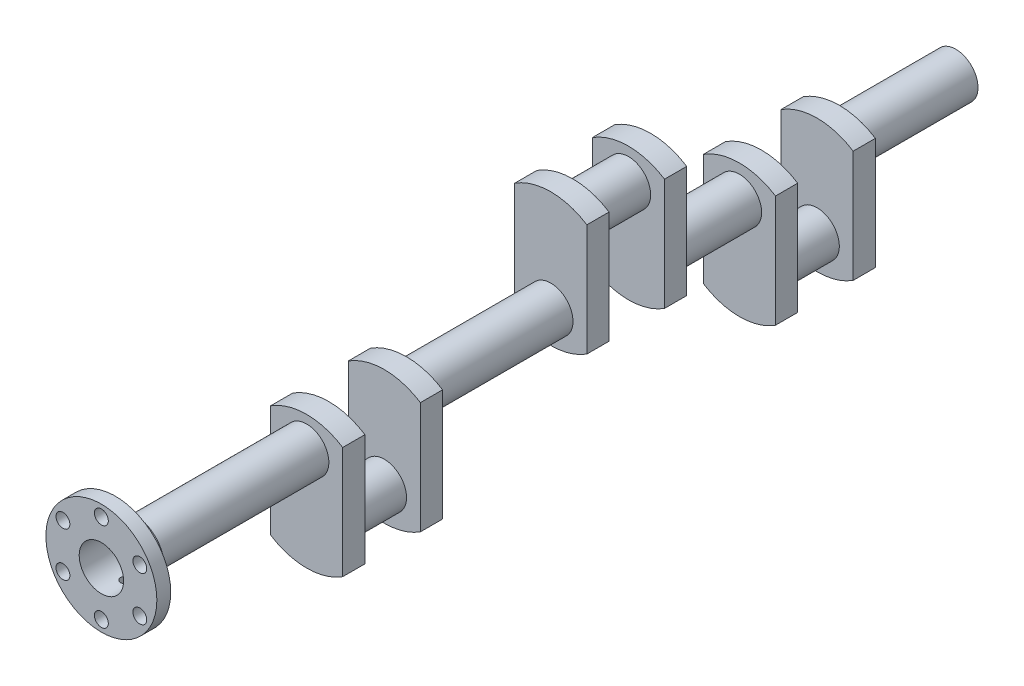
from build123d import *
from build123d.topology import SkipClean

# Parameters (mm, degrees)
SKETCH1_R            = 20
SKETCH1_R_2          = 2.5
SKETCH1_R_3          = 8
BOSS_EXTRUDE1_DEPTH  = 5
BOSS_EXTRUDE2_START  = 7
SKETCH2_R            = 10.633054962
SKETCH2_R_2          = 8
BOSS_EXTRUDE2_DEPTH  = 7
SKETCH3_R            = 8
BOSS_EXTRUDE3_DEPTH  = 62
SKETCH4_R            = 6
BOSS_EXTRUDE4_DEPTH  = 8
SKETCH5_R            = 1.5
CUT_EXTRUDE2_DEPTH   = 12.5
SKETCH6_R            = 6
BOSS_EXTRUDE6_DEPTH  = 8
SKETCH8_R            = 6
BOSS_EXTRUDE8_DEPTH  = 8
SKETCH9_R            = 8
BOSS_EXTRUDE9_DEPTH  = 20
SKETCH10_R           = 6
BOSS_EXTRUDE10_DEPTH = 8
SKETCH11_R           = 6
BOSS_EXTRUDE12_DEPTH = 8
SKETCH12_R           = 6
BOSS_EXTRUDE13_DEPTH = 8
BOSS_EXTRUDE14_START = 52
SKETCH13_R           = 8
BOSS_EXTRUDE14_DEPTH = 52
SKETCH14_R           = 6
BOSS_EXTRUDE15_DEPTH = 8
SKETCH15_R           = 6
BOSS_EXTRUDE17_DEPTH = 8
SKETCH16_R           = 6
BOSS_EXTRUDE18_DEPTH = 8
SKETCH17_R           = 8
BOSS_EXTRUDE23_DEPTH = 20
SKETCH21_R           = 6
BOSS_EXTRUDE24_DEPTH = 8
SKETCH22_R           = 6
BOSS_EXTRUDE26_DEPTH = 8
BOSS_EXTRUDE27_START = 32
SKETCH24_R           = 8
BOSS_EXTRUDE27_DEPTH = 32
SKETCH25_R           = 6
BOSS_EXTRUDE28_DEPTH = 8
SKETCH26_R           = 6
BOSS_EXTRUDE31_DEPTH = 8
SKETCH27_R           = 8
BOSS_EXTRUDE32_DEPTH = 20
SKETCH28_R           = 6
BOSS_EXTRUDE33_DEPTH = 8
SKETCH29_R           = 6
BOSS_EXTRUDE34_DEPTH = 8
BOSS_EXTRUDE35_START = 42
SKETCH30_R           = 8
BOSS_EXTRUDE35_DEPTH = 42


with BuildPart() as part:
    # Sketch1 → Boss-Extrude1 (new body)
    with BuildSketch(Plane.XY):
        Circle(SKETCH1_R)
        with Locations((0, 16)):
            Circle(SKETCH1_R_2, mode=Mode.SUBTRACT)
        with Locations((13.856406461, 8)):
            Circle(SKETCH1_R_2, mode=Mode.SUBTRACT)
        with Locations((13.856406461, -8)):
            Circle(SKETCH1_R_2, mode=Mode.SUBTRACT)
        with Locations((0, -16)):
            Circle(SKETCH1_R_2, mode=Mode.SUBTRACT)
        with Locations((-13.856406461, -8)):
            Circle(SKETCH1_R_2, mode=Mode.SUBTRACT)
        with Locations((-13.856406461, 8)):
            Circle(SKETCH1_R_2, mode=Mode.SUBTRACT)
        Circle(SKETCH1_R_3, mode=Mode.SUBTRACT)
    extrude(amount=BOSS_EXTRUDE1_DEPTH)

    # Sketch2 → Boss-Extrude2 (add)
    with SkipClean():  # the faces are left unmerged after this step: merging them gives an invalid solid
        with BuildSketch(Plane(origin=(0, 0, 0), x_dir=(-1, 0, 0), z_dir=(0, 0, -1)).offset(BOSS_EXTRUDE2_START)):
            with Locations(Location((0, 0, 0), (0, 0, 180))):
                Circle(SKETCH2_R)
            Circle(SKETCH2_R_2, mode=Mode.SUBTRACT)
        extrude(amount=-BOSS_EXTRUDE2_DEPTH)

    # Sketch5 → Cut-Extrude2 (cut, symmetric)
    with SkipClean():  # the faces are left unmerged after this step: merging them gives an invalid solid
        with BuildSketch(Plane(origin=(0, 0, 0), x_dir=(1, 0, 0), z_dir=(0, 1, 0))):
            with Locations(Location((0, 3.40192122, 0), (0, 0, 270))):
                Circle(SKETCH5_R)
        extrude(amount=CUT_EXTRUDE2_DEPTH, both=True, mode=Mode.SUBTRACT)


with BuildPart() as body_2:
    # Sketch3 → Boss-Extrude3 (new body)
    with BuildSketch(Plane(origin=(0, 0, -7), x_dir=(-1, 0, 0), z_dir=(0, 0, -1))):
        Circle(SKETCH3_R)
    extrude(amount=BOSS_EXTRUDE3_DEPTH)

    # Sketch4 → Boss-Extrude4 (add)
    with BuildSketch(Plane(origin=(0, 0, -69), x_dir=(-1, 0, 0), z_dir=(0, 0, -1))):
        Circle(SKETCH4_R)
    extrude(amount=BOSS_EXTRUDE4_DEPTH)

    # Sketch6 → Boss-Extrude6 (add)
    with BuildSketch(Plane(origin=(0, 0, -77), x_dir=(-1, 0, 0), z_dir=(0, 0, -1))):
        with BuildLine():
            Line((13, -25), (13, 7.174241002))
            ThreePointArc((13, 7.174241002), (0, 11), (-13, 7.174241002))
            Line((-13, 7.174241002), (-13, -25))
            Line((-13, -25), (-13, -33.174241002))
            ThreePointArc((-13, -33.174241002), (0, -37), (13, -33.174241002))
            Line((13, -33.174241002), (13, -25))
        make_face()
        Circle(SKETCH6_R, mode=Mode.SUBTRACT)
        with Locations((0, -25)):
            Circle(SKETCH6_R, mode=Mode.SUBTRACT)
    extrude(amount=-BOSS_EXTRUDE6_DEPTH)

    # Sketch8 → Boss-Extrude8 (add)
    with BuildSketch(Plane(origin=(0, 0, -77), x_dir=(-1, 0, 0), z_dir=(0, 0, -1))):
        with Locations((0, -25)):
            Circle(SKETCH8_R)
    extrude(amount=-BOSS_EXTRUDE8_DEPTH)

    # Sketch9 → Boss-Extrude9 (add)
    with BuildSketch(Plane(origin=(0, 0, -77), x_dir=(-1, 0, 0), z_dir=(0, 0, -1))):
        with Locations((0, -25)):
            Circle(SKETCH9_R)
    extrude(amount=BOSS_EXTRUDE9_DEPTH)

    # Sketch10 → Boss-Extrude10 (add)
    with BuildSketch(Plane(origin=(0, 0, -97), x_dir=(-1, 0, 0), z_dir=(0, 0, -1))):
        with Locations((0, -25)):
            Circle(SKETCH10_R)
    extrude(amount=BOSS_EXTRUDE10_DEPTH)

    # Sketch11 → Boss-Extrude12 (add)
    with BuildSketch(Plane(origin=(0, 0, -105), x_dir=(-1, 0, 0), z_dir=(0, 0, -1))):
        with BuildLine():
            Line((-13, 7.174241002), (-13, -33.174241002))
            ThreePointArc((-13, -33.174241002), (0, -37), (13, -33.174241002))
            Line((13, -33.174241002), (13, 7.174241002))
            ThreePointArc((13, 7.174241002), (0, 11), (-13, 7.174241002))
        make_face()
        with Locations((0, -25)):
            Circle(SKETCH11_R, mode=Mode.SUBTRACT)
        Circle(SKETCH11_R, mode=Mode.SUBTRACT)
    extrude(amount=-BOSS_EXTRUDE12_DEPTH)

    # Sketch12 → Boss-Extrude13 (add)
    with BuildSketch(Plane(origin=(0, 0, -105), x_dir=(-1, 0, 0), z_dir=(0, 0, -1))):
        Circle(SKETCH12_R)
    extrude(amount=-BOSS_EXTRUDE13_DEPTH)

    # Sketch13 → Boss-Extrude14 (add)
    with BuildSketch(Plane(origin=(0, 0, -105), x_dir=(-1, 0, 0), z_dir=(0, 0, -1)).offset(BOSS_EXTRUDE14_START)):
        Circle(SKETCH13_R)
    extrude(amount=-BOSS_EXTRUDE14_DEPTH)

    # Sketch14 → Boss-Extrude15 (add)
    with BuildSketch(Plane(origin=(0, 0, -157), x_dir=(-1, 0, 0), z_dir=(0, 0, -1))):
        Circle(SKETCH14_R)
    extrude(amount=BOSS_EXTRUDE15_DEPTH)

    # Sketch15 → Boss-Extrude17 (add)
    with BuildSketch(Plane(origin=(0, 0, -165), x_dir=(-1, 0, 0), z_dir=(0, 0, -1))):
        with BuildLine():
            Line((13, 32.674241002), (13, -7.674241002))
            ThreePointArc((13, -7.674241002), (0, -11.5), (-13, -7.674241002))
            Line((-13, -7.674241002), (-13, 32.674241002))
            ThreePointArc((-13, 32.674241002), (0, 36.5), (13, 32.674241002))
        make_face()
        Circle(SKETCH15_R, mode=Mode.SUBTRACT)
        with Locations((0, 25)):
            Circle(SKETCH15_R, mode=Mode.SUBTRACT)
    extrude(amount=-BOSS_EXTRUDE17_DEPTH)

    # Sketch16 → Boss-Extrude18 (add)
    with BuildSketch(Plane(origin=(0, 0, -165), x_dir=(-1, 0, 0), z_dir=(0, 0, -1))):
        with Locations((0, 25)):
            Circle(SKETCH16_R)
    extrude(amount=-BOSS_EXTRUDE18_DEPTH)

    # Sketch17 → Boss-Extrude23 (add)
    with BuildSketch(Plane(origin=(0, 0, -165), x_dir=(-1, 0, 0), z_dir=(0, 0, -1))):
        with Locations((0, 25.5)):
            Circle(SKETCH17_R)
    extrude(amount=BOSS_EXTRUDE23_DEPTH)

    # Sketch21 → Boss-Extrude24 (add)
    with BuildSketch(Plane(origin=(0, 0, -185), x_dir=(-1, 0, 0), z_dir=(0, 0, -1))):
        with Locations((0, 25.5)):
            Circle(SKETCH21_R)
    extrude(amount=BOSS_EXTRUDE24_DEPTH)

    # Sketch22 → Boss-Extrude26 (add)
    with BuildSketch(Plane(origin=(0, 0, -193), x_dir=(-1, 0, 0), z_dir=(0, 0, -1))):
        with BuildLine():
            ThreePointArc((13, 32.924241002), (0, 36.75), (-13, 32.924241002))
            Line((-13, 32.924241002), (-13, -7.424241002))
            ThreePointArc((-13, -7.424241002), (-12.80542496, -7.548302677), (-12.609666069, -7.670487791))
            ThreePointArc((-12.609666069, -7.670487791), (0.230758564, -11.248890609), (13, -7.424241002))
            Line((13, -7.424241002), (13, 32.674241002))
            Line((13, 32.674241002), (13, 32.924241002))
        make_face()
        with Locations((0, 25.5)):
            Circle(SKETCH22_R, mode=Mode.SUBTRACT)
    extrude(amount=-BOSS_EXTRUDE26_DEPTH)

    # Sketch24 → Boss-Extrude27 (add)
    with BuildSketch(Plane(origin=(0, 0, -193), x_dir=(-1, 0, 0), z_dir=(0, 0, -1)).offset(BOSS_EXTRUDE27_START)):
        Circle(SKETCH24_R)
    extrude(amount=-BOSS_EXTRUDE27_DEPTH)

    # Sketch25 → Boss-Extrude28 (add)
    with BuildSketch(Plane(origin=(0, 0, -225), x_dir=(-1, 0, 0), z_dir=(0, 0, -1))):
        Circle(SKETCH25_R)
    extrude(amount=BOSS_EXTRUDE28_DEPTH)

    # Sketch26 → Boss-Extrude31 (add)
    with BuildSketch(Plane(origin=(0, 0, -233), x_dir=(-1, 0, 0), z_dir=(0, 0, -1))):
        with BuildLine():
            Line((13, 7.674241002), (13, -32.674241002))
            ThreePointArc((13, -32.674241002), (0, -36.5), (-13, -32.674241002))
            Line((-13, -32.674241002), (-13, 7.674241002))
            ThreePointArc((-13, 7.674241002), (0, 11.5), (13, 7.674241002))
        make_face()
        Circle(SKETCH26_R, mode=Mode.SUBTRACT)
    extrude(amount=-BOSS_EXTRUDE31_DEPTH)

    # Sketch27 → Boss-Extrude32 (add)
    with BuildSketch(Plane(origin=(0, 0, -233), x_dir=(-1, 0, 0), z_dir=(0, 0, -1))):
        with Locations((0, -24.5)):
            Circle(SKETCH27_R)
    extrude(amount=BOSS_EXTRUDE32_DEPTH)

    # Sketch28 → Boss-Extrude33 (add)
    with BuildSketch(Plane(origin=(0, 0, -253), x_dir=(-1, 0, 0), z_dir=(0, 0, -1))):
        with Locations((0, -24.5)):
            Circle(SKETCH28_R)
    extrude(amount=BOSS_EXTRUDE33_DEPTH)

    # Sketch29 → Boss-Extrude34 (add)
    with BuildSketch(Plane(origin=(0, 0, -261), x_dir=(-1, 0, 0), z_dir=(0, 0, -1))):
        with BuildLine():
            Line((-13, 7.674241002), (-13, -32.674241002))
            ThreePointArc((-13, -32.674241002), (0, -36.5), (13, -32.674241002))
            Line((13, -32.674241002), (13, 7.674241002))
            ThreePointArc((13, 7.674241002), (0, 11.5), (-13, 7.674241002))
        make_face()
        with Locations((0, -24.5)):
            Circle(SKETCH29_R, mode=Mode.SUBTRACT)
    extrude(amount=-BOSS_EXTRUDE34_DEPTH)

    # Sketch30 → Boss-Extrude35 (add)
    with BuildSketch(Plane(origin=(0, 0, -261), x_dir=(-1, 0, 0), z_dir=(0, 0, -1)).offset(BOSS_EXTRUDE35_START)):
        Circle(SKETCH30_R)
    extrude(amount=-BOSS_EXTRUDE35_DEPTH)


solid = Compound([part.part, body_2.part])
